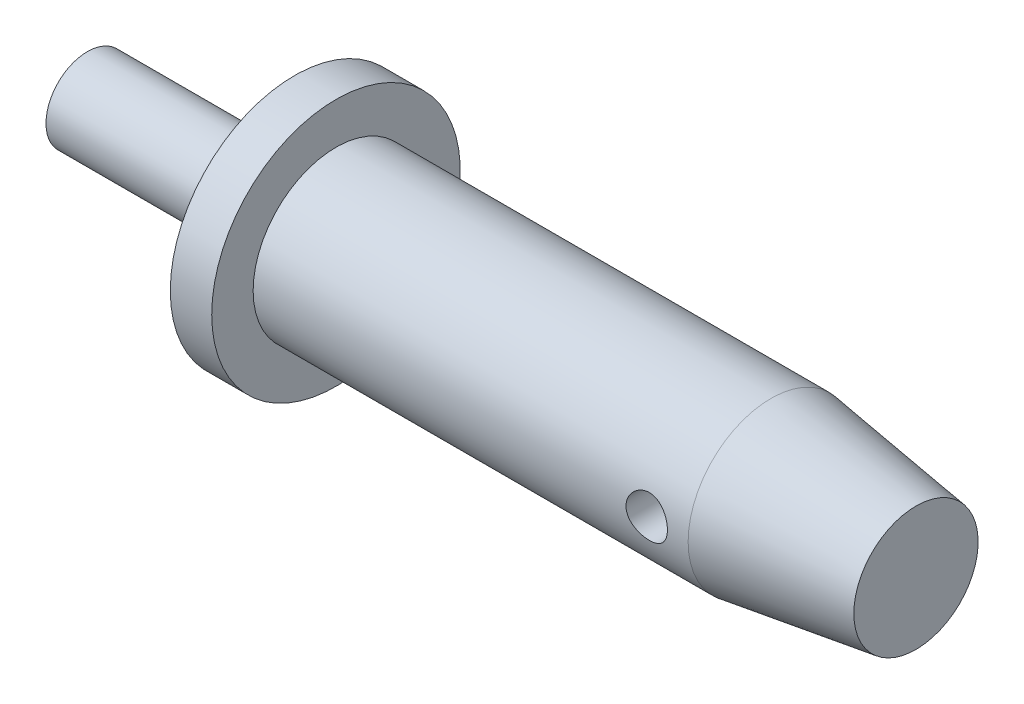
from build123d import *

# Parameters (mm, degrees)
SKETCH_2_R          = 5
CUT_EXTRUDE_1_DEPTH = 209.32666656


with BuildPart() as part:
    # 草图1 → 旋转1 (revolve)
    with BuildSketch(Plane.XY, mode=Mode.PRIVATE) as revolve_1_sk:
        Polygon((0, 0), (200, 0), (200, 15), (165, 20), (60, 20), (60, 30), (50, 30), (50, 10), (0, 10), align=None)
    revolve(revolve_1_sk.sketch.rotate(Axis((0, 0, 0), (1, 0, 0)), 90), axis=Axis((0, 0, 0), (1, 0, 0)))

    # 草图2 → 切除-拉伸1 (cut, through all)
    with BuildSketch(Plane.XY.offset(20)):
        with Locations((155, 0)):
            Circle(SKETCH_2_R)
    extrude(amount=-CUT_EXTRUDE_1_DEPTH, mode=Mode.SUBTRACT)


solid = part.part
